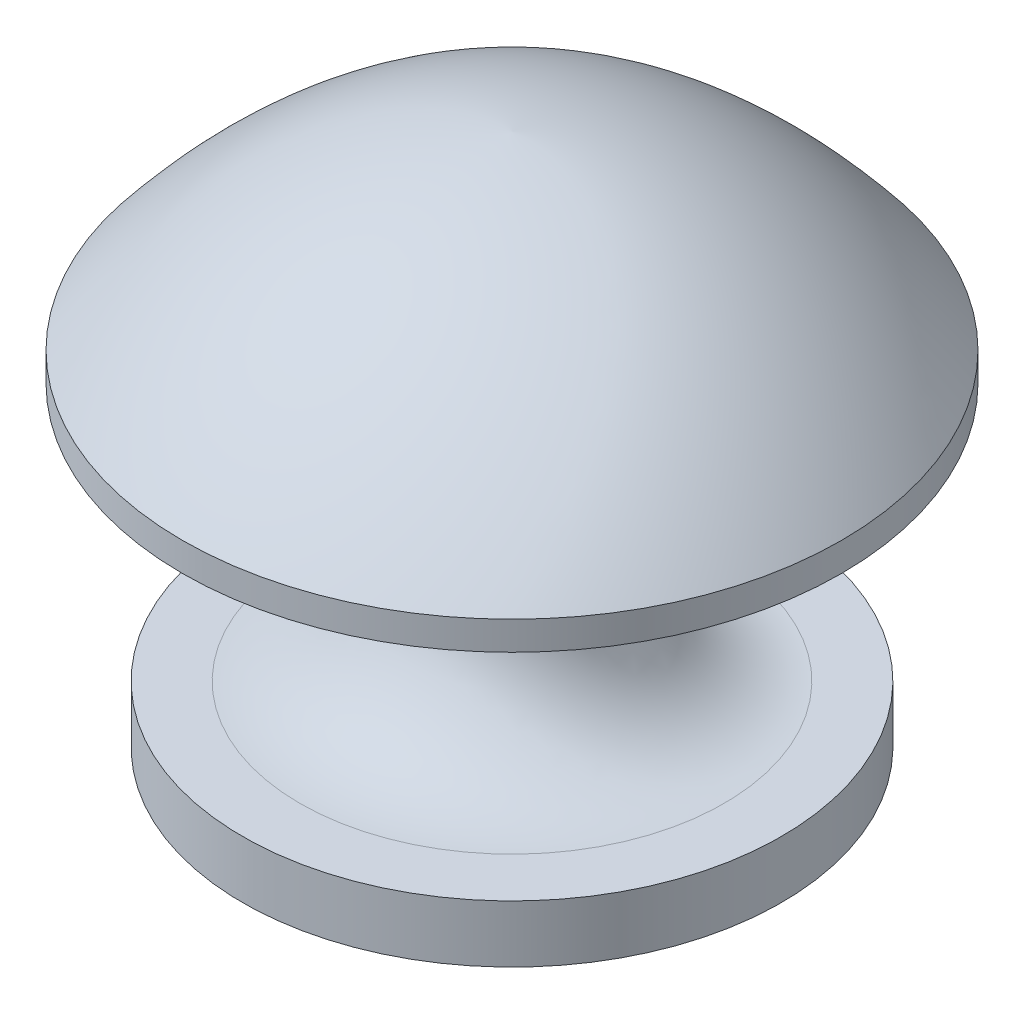
from build123d import *


with BuildPart() as part:
    # Sketch1 → Revolve1 (revolve)
    with BuildSketch(Plane.XY, mode=Mode.PRIVATE) as revolve1_sk:
        with BuildLine():
            Line((0, 0), (-11.938, 0))
            Line((-11.938, 0), (-11.938, 2.54))
            Line((-11.938, 2.54), (-9.398, 2.54))
            ThreePointArc((-9.398, 2.54), (-3.683, 8.255), (-9.398, 13.97))
            Line((-9.398, 13.97), (-14.605, 13.97))
            Line((-14.605, 13.97), (-14.605, 15.24))
            add(Edge.make_bspline(
                [(-14.605, 15.24), (-8.278988418, 23.094212904), (0, 23.622)],
                knots=[0, 0, 0, 0.874066548, 0.874066548, 0.874066548], degree=2))
            Line((0, 23.622), (0, 0))
        make_face()
    revolve(revolve1_sk.sketch.rotate(Axis((0, 0, 0), (0, 1, 0)), 270), axis=Axis((0, 0, 0), (0, 1, 0)))


solid = part.part
